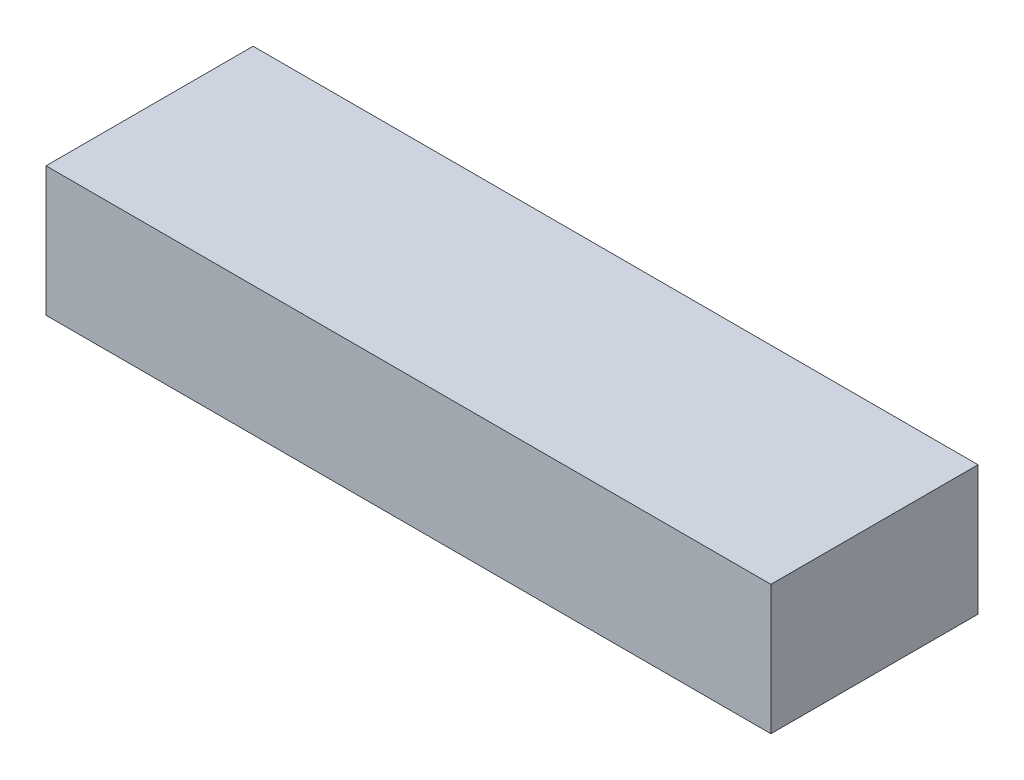
from build123d import *

# Parameters (mm, degrees)
SKETCH1_W           = 40
SKETCH1_H           = 25
BOSS_EXTRUDE1_DEPTH = 70


with BuildPart() as part:
    # Sketch1 → Boss-Extrude1 (new, symmetric)
    with BuildSketch(Plane(origin=(0, 0, 0), x_dir=(0, 0, -1), z_dir=(1, 0, 0))):
        Rectangle(SKETCH1_W, SKETCH1_H)
    extrude(amount=BOSS_EXTRUDE1_DEPTH, both=True)


solid = part.part
